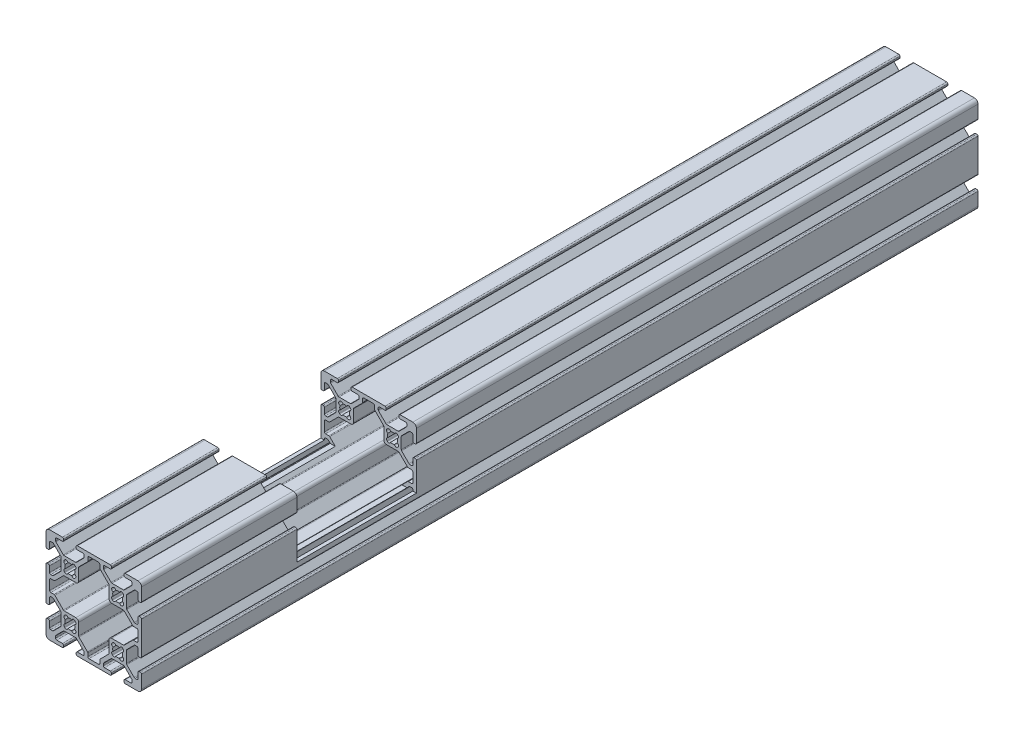
from build123d import *

# Parameters (mm, degrees)
EXTRUDE1_DEPTH     = 350
SKETCH2_W          = 50
SKETCH2_H          = 25
CUT_EXTRUDE2_DEPTH = 62


with BuildPart() as part:
    # Sketch1 → Extrude1 (new body)
    with BuildSketch(Plane.XY):
        with BuildLine():
            Line((-22.383919339, -3.655), (-17.616080661, -3.655))
            ThreePointArc((-17.616080661, -3.655), (-17.421677478, -3.693669197), (-17.256870417, -3.803789755))
            Line((-17.256870417, -3.803789755), (-14.153789755, -6.906870417))
            ThreePointArc((-14.153789755, -6.906870417), (-14.043669197, -7.071677478), (-14.005, -7.266080661))
            Line((-14.005, -7.266080661), (-14.005, -7.992))
            ThreePointArc((-14.005, -7.992), (-14.153789755, -8.351210245), (-14.513, -8.5))
            Line((-14.513, -8.5), (-16.862, -8.5))
            ThreePointArc((-16.862, -8.5), (-17.221210245, -8.648789755), (-17.37, -9.008))
            Line((-17.37, -9.008), (-17.37, -9.492))
            ThreePointArc((-17.37, -9.492), (-17.221210245, -9.851210245), (-16.862, -10))
            Line((-16.862, -10), (-3.138, -10))
            ThreePointArc((-3.138, -10), (-2.778789755, -9.851210245), (-2.63, -9.492))
            Line((-2.63, -9.492), (-2.63, -9.008))
            ThreePointArc((-2.63, -9.008), (-2.778789755, -8.648789755), (-3.138, -8.5))
            Line((-3.138, -8.5), (-5.487, -8.5))
            ThreePointArc((-5.487, -8.5), (-5.846210245, -8.351210245), (-5.995, -7.992))
            Line((-5.995, -7.992), (-5.995, -7.266080661))
            ThreePointArc((-5.995, -7.266080661), (-5.956330803, -7.071677478), (-5.846210245, -6.906870417))
            Line((-5.846210245, -6.906870417), (-2.743129583, -3.803789755))
            ThreePointArc((-2.743129583, -3.803789755), (-2.578322522, -3.693669197), (-2.383919339, -3.655))
            Line((-2.383919339, -3.655), (2.383919339, -3.655))
            ThreePointArc((2.383919339, -3.655), (2.578322522, -3.693669197), (2.743129583, -3.803789755))
            Line((2.743129583, -3.803789755), (5.846210245, -6.906870417))
            ThreePointArc((5.846210245, -6.906870417), (5.956330803, -7.071677478), (5.995, -7.266080661))
            Line((5.995, -7.266080661), (5.995, -7.992))
            ThreePointArc((5.995, -7.992), (5.846210245, -8.351210245), (5.487, -8.5))
            Line((5.487, -8.5), (3.138, -8.5))
            ThreePointArc((3.138, -8.5), (2.778789755, -8.648789755), (2.63, -9.008))
            Line((2.63, -9.008), (2.63, -9.492))
            ThreePointArc((2.63, -9.492), (2.778789755, -9.851210245), (3.138, -10))
            Line((3.138, -10), (8.5, -10))
            ThreePointArc((8.5, -10), (9.560660172, -9.560660172), (10, -8.5))
            Line((10, -8.5), (10, -3.138))
            ThreePointArc((10, -3.138), (9.851210245, -2.778789755), (9.492, -2.63))
            Line((9.492, -2.63), (9.008, -2.63))
            ThreePointArc((9.008, -2.63), (8.648789755, -2.778789755), (8.5, -3.138))
            Line((8.5, -3.138), (8.5, -5.487))
            ThreePointArc((8.5, -5.487), (8.351210245, -5.846210245), (7.992, -5.995))
            Line((7.992, -5.995), (7.266080661, -5.995))
            ThreePointArc((7.266080661, -5.995), (7.071677478, -5.956330803), (6.906870417, -5.846210245))
            Line((6.906870417, -5.846210245), (3.803789755, -2.743129583))
            ThreePointArc((3.803789755, -2.743129583), (3.693669197, -2.578322522), (3.655, -2.383919339))
            Line((3.655, -2.383919339), (3.655, 2.383919339))
            ThreePointArc((3.655, 2.383919339), (3.693669197, 2.578322522), (3.803789755, 2.743129583))
            Line((3.803789755, 2.743129583), (6.906870417, 5.846210245))
            ThreePointArc((6.906870417, 5.846210245), (7.071677478, 5.956330803), (7.266080661, 5.995))
            Line((7.266080661, 5.995), (7.992, 5.995))
            ThreePointArc((7.992, 5.995), (8.351210245, 5.846210245), (8.5, 5.487))
            Line((8.5, 5.487), (8.5, 3.138))
            ThreePointArc((8.5, 3.138), (8.648789755, 2.778789755), (9.008, 2.63))
            Line((9.008, 2.63), (9.492, 2.63))
            ThreePointArc((9.492, 2.63), (9.851210245, 2.778789755), (10, 3.138))
            Line((10, 3.138), (10, 16.862))
            ThreePointArc((10, 16.862), (9.851210245, 17.221210245), (9.492, 17.37))
            Line((9.492, 17.37), (9.008, 17.37))
            ThreePointArc((9.008, 17.37), (8.648789755, 17.221210245), (8.5, 16.862))
            Line((8.5, 16.862), (8.5, 14.513))
            ThreePointArc((8.5, 14.513), (8.351210245, 14.153789755), (7.992, 14.005))
            Line((7.992, 14.005), (7.266080661, 14.005))
            ThreePointArc((7.266080661, 14.005), (7.071677478, 14.043669197), (6.906870417, 14.153789755))
            Line((6.906870417, 14.153789755), (3.803789755, 17.256870417))
            ThreePointArc((3.803789755, 17.256870417), (3.693669197, 17.421677478), (3.655, 17.616080661))
            Line((3.655, 17.616080661), (3.655, 22.383919339))
            ThreePointArc((3.655, 22.383919339), (3.693669197, 22.578322522), (3.803789755, 22.743129583))
            Line((3.803789755, 22.743129583), (6.906870417, 25.846210245))
            ThreePointArc((6.906870417, 25.846210245), (7.071677478, 25.956330803), (7.266080661, 25.995))
            Line((7.266080661, 25.995), (7.992, 25.995))
            ThreePointArc((7.992, 25.995), (8.351210245, 25.846210245), (8.5, 25.487))
            Line((8.5, 25.487), (8.5, 23.138))
            ThreePointArc((8.5, 23.138), (8.648789755, 22.778789755), (9.008, 22.63))
            Line((9.008, 22.63), (9.492, 22.63))
            ThreePointArc((9.492, 22.63), (9.851210245, 22.778789755), (10, 23.138))
            Line((10, 23.138), (10, 28.5))
            ThreePointArc((10, 28.5), (9.560660172, 29.560660172), (8.5, 30))
            Line((8.5, 30), (3.138, 30))
            ThreePointArc((3.138, 30), (2.778789755, 29.851210245), (2.63, 29.492))
            Line((2.63, 29.492), (2.63, 29.008))
            ThreePointArc((2.63, 29.008), (2.778789755, 28.648789755), (3.138, 28.5))
            Line((3.138, 28.5), (5.487, 28.5))
            ThreePointArc((5.487, 28.5), (5.846210245, 28.351210245), (5.995, 27.992))
            Line((5.995, 27.992), (5.995, 27.266080661))
            ThreePointArc((5.995, 27.266080661), (5.956330803, 27.071677478), (5.846210245, 26.906870417))
            Line((5.846210245, 26.906870417), (2.743129583, 23.803789755))
            ThreePointArc((2.743129583, 23.803789755), (2.578322522, 23.693669197), (2.383919339, 23.655))
            Line((2.383919339, 23.655), (-2.383919339, 23.655))
            ThreePointArc((-2.383919339, 23.655), (-2.578322522, 23.693669197), (-2.743129583, 23.803789755))
            Line((-2.743129583, 23.803789755), (-5.846210245, 26.906870417))
            ThreePointArc((-5.846210245, 26.906870417), (-5.956330803, 27.071677478), (-5.995, 27.266080661))
            Line((-5.995, 27.266080661), (-5.995, 27.992))
            ThreePointArc((-5.995, 27.992), (-5.846210245, 28.351210245), (-5.487, 28.5))
            Line((-5.487, 28.5), (-3.138, 28.5))
            ThreePointArc((-3.138, 28.5), (-2.778789755, 28.648789755), (-2.63, 29.008))
            Line((-2.63, 29.008), (-2.63, 29.492))
            ThreePointArc((-2.63, 29.492), (-2.778789755, 29.851210245), (-3.138, 30))
            Line((-3.138, 30), (-16.862, 30))
            ThreePointArc((-16.862, 30), (-17.221210245, 29.851210245), (-17.37, 29.492))
            Line((-17.37, 29.492), (-17.37, 29.008))
            ThreePointArc((-17.37, 29.008), (-17.221210245, 28.648789755), (-16.862, 28.5))
            Line((-16.862, 28.5), (-14.513, 28.5))
            ThreePointArc((-14.513, 28.5), (-14.153789755, 28.351210245), (-14.005, 27.992))
            Line((-14.005, 27.992), (-14.005, 27.266080661))
            ThreePointArc((-14.005, 27.266080661), (-14.043669197, 27.071677478), (-14.153789755, 26.906870417))
            Line((-14.153789755, 26.906870417), (-17.256870417, 23.803789755))
            ThreePointArc((-17.256870417, 23.803789755), (-17.421677478, 23.693669197), (-17.616080661, 23.655))
            Line((-17.616080661, 23.655), (-22.383919339, 23.655))
            ThreePointArc((-22.383919339, 23.655), (-22.578322522, 23.693669197), (-22.743129583, 23.803789755))
            Line((-22.743129583, 23.803789755), (-25.846210245, 26.906870417))
            ThreePointArc((-25.846210245, 26.906870417), (-25.956330803, 27.071677478), (-25.995, 27.266080661))
            Line((-25.995, 27.266080661), (-25.995, 27.992))
            ThreePointArc((-25.995, 27.992), (-25.846210245, 28.351210245), (-25.487, 28.5))
            Line((-25.487, 28.5), (-23.138, 28.5))
            ThreePointArc((-23.138, 28.5), (-22.778789755, 28.648789755), (-22.63, 29.008))
            Line((-22.63, 29.008), (-22.63, 29.492))
            ThreePointArc((-22.63, 29.492), (-22.778789755, 29.851210245), (-23.138, 30))
            Line((-23.138, 30), (-28.5, 30))
            ThreePointArc((-28.5, 30), (-29.560660172, 29.560660172), (-30, 28.5))
            Line((-30, 28.5), (-30, 23.138))
            ThreePointArc((-30, 23.138), (-29.851210245, 22.778789755), (-29.492, 22.63))
            Line((-29.492, 22.63), (-29.008, 22.63))
            ThreePointArc((-29.008, 22.63), (-28.648789755, 22.778789755), (-28.5, 23.138))
            Line((-28.5, 23.138), (-28.5, 25.487))
            ThreePointArc((-28.5, 25.487), (-28.351210245, 25.846210245), (-27.992, 25.995))
            Line((-27.992, 25.995), (-27.266080661, 25.995))
            ThreePointArc((-27.266080661, 25.995), (-27.071677478, 25.956330803), (-26.906870417, 25.846210245))
            Line((-26.906870417, 25.846210245), (-23.803789755, 22.743129583))
            ThreePointArc((-23.803789755, 22.743129583), (-23.693669197, 22.578322522), (-23.655, 22.383919339))
            Line((-23.655, 22.383919339), (-23.655, 17.616080661))
            ThreePointArc((-23.655, 17.616080661), (-23.693669197, 17.421677478), (-23.803789755, 17.256870417))
            Line((-23.803789755, 17.256870417), (-26.906870417, 14.153789755))
            ThreePointArc((-26.906870417, 14.153789755), (-27.071677478, 14.043669197), (-27.266080661, 14.005))
            Line((-27.266080661, 14.005), (-27.992, 14.005))
            ThreePointArc((-27.992, 14.005), (-28.351210245, 14.153789755), (-28.5, 14.513))
            Line((-28.5, 14.513), (-28.5, 16.862))
            ThreePointArc((-28.5, 16.862), (-28.648789755, 17.221210245), (-29.008, 17.37))
            Line((-29.008, 17.37), (-29.492, 17.37))
            ThreePointArc((-29.492, 17.37), (-29.851210245, 17.221210245), (-30, 16.862))
            Line((-30, 16.862), (-30, 3.138))
            ThreePointArc((-30, 3.138), (-29.851210245, 2.778789755), (-29.492, 2.63))
            Line((-29.492, 2.63), (-29.008, 2.63))
            ThreePointArc((-29.008, 2.63), (-28.648789755, 2.778789755), (-28.5, 3.138))
            Line((-28.5, 3.138), (-28.5, 5.487))
            ThreePointArc((-28.5, 5.487), (-28.351210245, 5.846210245), (-27.992, 5.995))
            Line((-27.992, 5.995), (-27.266080661, 5.995))
            ThreePointArc((-27.266080661, 5.995), (-27.071677478, 5.956330803), (-26.906870417, 5.846210245))
            Line((-26.906870417, 5.846210245), (-23.803789755, 2.743129583))
            ThreePointArc((-23.803789755, 2.743129583), (-23.693669197, 2.578322522), (-23.655, 2.383919339))
            Line((-23.655, 2.383919339), (-23.655, -2.383919339))
            ThreePointArc((-23.655, -2.383919339), (-23.693669197, -2.578322522), (-23.803789755, -2.743129583))
            Line((-23.803789755, -2.743129583), (-26.906870417, -5.846210245))
            ThreePointArc((-26.906870417, -5.846210245), (-27.071677478, -5.956330803), (-27.266080661, -5.995))
            Line((-27.266080661, -5.995), (-27.992, -5.995))
            ThreePointArc((-27.992, -5.995), (-28.351210245, -5.846210245), (-28.5, -5.487))
            Line((-28.5, -5.487), (-28.5, -3.138))
            ThreePointArc((-28.5, -3.138), (-28.648789755, -2.778789755), (-29.008, -2.63))
            Line((-29.008, -2.63), (-29.492, -2.63))
            ThreePointArc((-29.492, -2.63), (-29.851210245, -2.778789755), (-30, -3.138))
            Line((-30, -3.138), (-30, -8.5))
            ThreePointArc((-30, -8.5), (-29.560660172, -9.560660172), (-28.5, -10))
            Line((-28.5, -10), (-23.138, -10))
            ThreePointArc((-23.138, -10), (-22.778789755, -9.851210245), (-22.63, -9.492))
            Line((-22.63, -9.492), (-22.63, -9.008))
            ThreePointArc((-22.63, -9.008), (-22.778789755, -8.648789755), (-23.138, -8.5))
            Line((-23.138, -8.5), (-25.487, -8.5))
            ThreePointArc((-25.487, -8.5), (-25.846210245, -8.351210245), (-25.995, -7.992))
            Line((-25.995, -7.992), (-25.995, -7.266080661))
            ThreePointArc((-25.995, -7.266080661), (-25.956330803, -7.071677478), (-25.846210245, -6.906870417))
            Line((-25.846210245, -6.906870417), (-22.743129583, -3.803789755))
            ThreePointArc((-22.743129583, -3.803789755), (-22.578322522, -3.693669197), (-22.383919339, -3.655))
        make_face()
        with BuildLine():
            Line((-2.124900844, 17.695494034), (-2.304505966, 17.875099156))
            ThreePointArc((-2.304505966, 17.875099156), (-2.505938017, 18.643532189), (-1.935133506, 19.196023282))
            ThreePointArc((-1.935133506, 19.196023282), (-2.0955, 20), (-1.935133506, 20.803976718))
            ThreePointArc((-1.935133506, 20.803976718), (-2.505938017, 21.356467811), (-2.304505966, 22.124900844))
            Line((-2.304505966, 22.124900844), (-2.124900844, 22.304505966))
            ThreePointArc((-2.124900844, 22.304505966), (-1.356467811, 22.505938017), (-0.803976718, 21.935133506))
            ThreePointArc((-0.803976718, 21.935133506), (0, 22.0955), (0.803976718, 21.935133506))
            ThreePointArc((0.803976718, 21.935133506), (1.356467811, 22.505938017), (2.124900844, 22.304505966))
            Line((2.124900844, 22.304505966), (2.304505966, 22.124900844))
            ThreePointArc((2.304505966, 22.124900844), (2.505938017, 21.356467811), (1.935133506, 20.803976718))
            ThreePointArc((1.935133506, 20.803976718), (2.0955, 20), (1.935133506, 19.196023282))
            ThreePointArc((1.935133506, 19.196023282), (2.505938017, 18.643532189), (2.304505966, 17.875099156))
            Line((2.304505966, 17.875099156), (2.124900844, 17.695494034))
            ThreePointArc((2.124900844, 17.695494034), (1.356467811, 17.494061983), (0.803976718, 18.064866494))
            ThreePointArc((0.803976718, 18.064866494), (0, 17.9045), (-0.803976718, 18.064866494))
            ThreePointArc((-0.803976718, 18.064866494), (-1.356467811, 17.494061983), (-2.124900844, 17.695494034))
        make_face(mode=Mode.SUBTRACT)
        with BuildLine():
            Line((-22.124900844, 17.695494034), (-22.304505966, 17.875099156))
            ThreePointArc((-22.304505966, 17.875099156), (-22.505938017, 18.643532189), (-21.935133506, 19.196023282))
            ThreePointArc((-21.935133506, 19.196023282), (-22.0955, 20), (-21.935133506, 20.803976718))
            ThreePointArc((-21.935133506, 20.803976718), (-22.505938017, 21.356467811), (-22.304505966, 22.124900844))
            Line((-22.304505966, 22.124900844), (-22.124900844, 22.304505966))
            ThreePointArc((-22.124900844, 22.304505966), (-21.356467811, 22.505938017), (-20.803976718, 21.935133506))
            ThreePointArc((-20.803976718, 21.935133506), (-20, 22.0955), (-19.196023282, 21.935133506))
            ThreePointArc((-19.196023282, 21.935133506), (-18.643532189, 22.505938017), (-17.875099156, 22.304505966))
            Line((-17.875099156, 22.304505966), (-17.695494034, 22.124900844))
            ThreePointArc((-17.695494034, 22.124900844), (-17.494061983, 21.356467811), (-18.064866494, 20.803976718))
            ThreePointArc((-18.064866494, 20.803976718), (-17.9045, 20), (-18.064866494, 19.196023282))
            ThreePointArc((-18.064866494, 19.196023282), (-17.494061983, 18.643532189), (-17.695494034, 17.875099156))
            Line((-17.695494034, 17.875099156), (-17.875099156, 17.695494034))
            ThreePointArc((-17.875099156, 17.695494034), (-18.643532189, 17.494061983), (-19.196023282, 18.064866494))
            ThreePointArc((-19.196023282, 18.064866494), (-20, 17.9045), (-20.803976718, 18.064866494))
            ThreePointArc((-20.803976718, 18.064866494), (-21.356467811, 17.494061983), (-22.124900844, 17.695494034))
        make_face(mode=Mode.SUBTRACT)
        with BuildLine():
            Line((-2.124900844, -2.304505966), (-2.304505966, -2.124900844))
            ThreePointArc((-2.304505966, -2.124900844), (-2.505938017, -1.356467811), (-1.935133506, -0.803976718))
            ThreePointArc((-1.935133506, -0.803976718), (-2.0955, 0), (-1.935133506, 0.803976718))
            ThreePointArc((-1.935133506, 0.803976718), (-2.505938017, 1.356467811), (-2.304505966, 2.124900844))
            Line((-2.304505966, 2.124900844), (-2.124900844, 2.304505966))
            ThreePointArc((-2.124900844, 2.304505966), (-1.356467811, 2.505938017), (-0.803976718, 1.935133506))
            ThreePointArc((-0.803976718, 1.935133506), (0, 2.0955), (0.803976718, 1.935133506))
            ThreePointArc((0.803976718, 1.935133506), (1.356467811, 2.505938017), (2.124900844, 2.304505966))
            Line((2.124900844, 2.304505966), (2.304505966, 2.124900844))
            ThreePointArc((2.304505966, 2.124900844), (2.505938017, 1.356467811), (1.935133506, 0.803976718))
            ThreePointArc((1.935133506, 0.803976718), (2.0955, 0), (1.935133506, -0.803976718))
            ThreePointArc((1.935133506, -0.803976718), (2.505938017, -1.356467811), (2.304505966, -2.124900844))
            Line((2.304505966, -2.124900844), (2.124900844, -2.304505966))
            ThreePointArc((2.124900844, -2.304505966), (1.356467811, -2.505938017), (0.803976718, -1.935133506))
            ThreePointArc((0.803976718, -1.935133506), (0, -2.0955), (-0.803976718, -1.935133506))
            ThreePointArc((-0.803976718, -1.935133506), (-1.356467811, -2.505938017), (-2.124900844, -2.304505966))
        make_face(mode=Mode.SUBTRACT)
        with BuildLine():
            Line((-12.505, -7.992), (-12.505, -6.644760318))
            ThreePointArc((-12.505, -6.644760318), (-12.543669197, -6.450357134), (-12.653789755, -6.285550073))
            Line((-12.653789755, -6.285550073), (-16.196210245, -2.743129583))
            ThreePointArc((-16.196210245, -2.743129583), (-16.306330803, -2.578322522), (-16.345, -2.383919339))
            Line((-16.345, -2.383919339), (-16.345, 2.512))
            ThreePointArc((-16.345, 2.512), (-16.679776949, 3.320223051), (-17.488, 3.655))
            Line((-17.488, 3.655), (-22.383919339, 3.655))
            ThreePointArc((-22.383919339, 3.655), (-22.578322522, 3.693669197), (-22.743129583, 3.803789755))
            Line((-22.743129583, 3.803789755), (-26.285550073, 7.346210245))
            ThreePointArc((-26.285550073, 7.346210245), (-26.450357134, 7.456330803), (-26.644760318, 7.495))
            Line((-26.644760318, 7.495), (-27.992, 7.495))
            ThreePointArc((-27.992, 7.495), (-28.351210245, 7.643789755), (-28.5, 8.003))
            Line((-28.5, 8.003), (-28.5, 11.997))
            ThreePointArc((-28.5, 11.997), (-28.351210245, 12.356210245), (-27.992, 12.505))
            Line((-27.992, 12.505), (-26.644760318, 12.505))
            ThreePointArc((-26.644760318, 12.505), (-26.450357134, 12.543669197), (-26.285550073, 12.653789755))
            Line((-26.285550073, 12.653789755), (-22.743129583, 16.196210245))
            ThreePointArc((-22.743129583, 16.196210245), (-22.578322522, 16.306330803), (-22.383919339, 16.345))
            Line((-22.383919339, 16.345), (-17.488, 16.345))
            ThreePointArc((-17.488, 16.345), (-16.679776949, 16.679776949), (-16.345, 17.488))
            Line((-16.345, 17.488), (-16.345, 22.383919339))
            ThreePointArc((-16.345, 22.383919339), (-16.306330803, 22.578322522), (-16.196210245, 22.743129583))
            Line((-16.196210245, 22.743129583), (-12.653789755, 26.285550073))
            ThreePointArc((-12.653789755, 26.285550073), (-12.543669197, 26.450357134), (-12.505, 26.644760318))
            Line((-12.505, 26.644760318), (-12.505, 27.992))
            ThreePointArc((-12.505, 27.992), (-12.356210245, 28.351210245), (-11.997, 28.5))
            Line((-11.997, 28.5), (-8.003, 28.5))
            ThreePointArc((-8.003, 28.5), (-7.643789755, 28.351210245), (-7.495, 27.992))
            Line((-7.495, 27.992), (-7.495, 26.644760318))
            ThreePointArc((-7.495, 26.644760318), (-7.456330803, 26.450357134), (-7.346210245, 26.285550073))
            Line((-7.346210245, 26.285550073), (-3.803789755, 22.743129583))
            ThreePointArc((-3.803789755, 22.743129583), (-3.693669197, 22.578322522), (-3.655, 22.383919339))
            Line((-3.655, 22.383919339), (-3.655, 17.488))
            ThreePointArc((-3.655, 17.488), (-3.320223051, 16.679776949), (-2.512, 16.345))
            Line((-2.512, 16.345), (2.383919339, 16.345))
            ThreePointArc((2.383919339, 16.345), (2.578322522, 16.306330803), (2.743129583, 16.196210245))
            Line((2.743129583, 16.196210245), (6.285550073, 12.653789755))
            ThreePointArc((6.285550073, 12.653789755), (6.450357134, 12.543669197), (6.644760318, 12.505))
            Line((6.644760318, 12.505), (7.992, 12.505))
            ThreePointArc((7.992, 12.505), (8.351210245, 12.356210245), (8.5, 11.997))
            Line((8.5, 11.997), (8.5, 8.003))
            ThreePointArc((8.5, 8.003), (8.351210245, 7.643789755), (7.992, 7.495))
            Line((7.992, 7.495), (6.644760318, 7.495))
            ThreePointArc((6.644760318, 7.495), (6.450357134, 7.456330803), (6.285550073, 7.346210245))
            Line((6.285550073, 7.346210245), (2.743129583, 3.803789755))
            ThreePointArc((2.743129583, 3.803789755), (2.578322522, 3.693669197), (2.383919339, 3.655))
            Line((2.383919339, 3.655), (-2.512, 3.655))
            ThreePointArc((-2.512, 3.655), (-3.320223051, 3.320223051), (-3.655, 2.512))
            Line((-3.655, 2.512), (-3.655, -2.383919339))
            ThreePointArc((-3.655, -2.383919339), (-3.693669197, -2.578322522), (-3.803789755, -2.743129583))
            Line((-3.803789755, -2.743129583), (-7.346210245, -6.285550073))
            ThreePointArc((-7.346210245, -6.285550073), (-7.456330803, -6.450357134), (-7.495, -6.644760318))
            Line((-7.495, -6.644760318), (-7.495, -7.992))
            ThreePointArc((-7.495, -7.992), (-7.643789755, -8.351210245), (-8.003, -8.5))
            Line((-8.003, -8.5), (-11.997, -8.5))
            ThreePointArc((-11.997, -8.5), (-12.356210245, -8.351210245), (-12.505, -7.992))
        make_face(mode=Mode.SUBTRACT)
        with BuildLine():
            Line((-22.124900844, -2.304505966), (-22.304505966, -2.124900844))
            ThreePointArc((-22.304505966, -2.124900844), (-22.505938017, -1.356467811), (-21.935133506, -0.803976718))
            ThreePointArc((-21.935133506, -0.803976718), (-22.0955, 0), (-21.935133506, 0.803976718))
            ThreePointArc((-21.935133506, 0.803976718), (-22.505938017, 1.356467811), (-22.304505966, 2.124900844))
            Line((-22.304505966, 2.124900844), (-22.124900844, 2.304505966))
            ThreePointArc((-22.124900844, 2.304505966), (-21.356467811, 2.505938017), (-20.803976718, 1.935133506))
            ThreePointArc((-20.803976718, 1.935133506), (-20, 2.0955), (-19.196023282, 1.935133506))
            ThreePointArc((-19.196023282, 1.935133506), (-18.643532189, 2.505938017), (-17.875099156, 2.304505966))
            Line((-17.875099156, 2.304505966), (-17.695494034, 2.124900844))
            ThreePointArc((-17.695494034, 2.124900844), (-17.494061983, 1.356467811), (-18.064866494, 0.803976718))
            ThreePointArc((-18.064866494, 0.803976718), (-17.9045, 0), (-18.064866494, -0.803976718))
            ThreePointArc((-18.064866494, -0.803976718), (-17.494061983, -1.356467811), (-17.695494034, -2.124900844))
            Line((-17.695494034, -2.124900844), (-17.875099156, -2.304505966))
            ThreePointArc((-17.875099156, -2.304505966), (-18.643532189, -2.505938017), (-19.196023282, -1.935133506))
            ThreePointArc((-19.196023282, -1.935133506), (-20, -2.0955), (-20.803976718, -1.935133506))
            ThreePointArc((-20.803976718, -1.935133506), (-21.356467811, -2.505938017), (-22.124900844, -2.304505966))
        make_face(mode=Mode.SUBTRACT)
    extrude(amount=-EXTRUDE1_DEPTH)

    # Sketch2 → Cut-Extrude2 (cut)
    with BuildSketch(Plane(origin=(10, 0, 0), x_dir=(0, 0, -1), z_dir=(1, 0, 0))):
        with Locations((90, 17.5)):
            Rectangle(SKETCH2_W, SKETCH2_H)
    extrude(amount=-CUT_EXTRUDE2_DEPTH, mode=Mode.SUBTRACT)


solid = part.part
